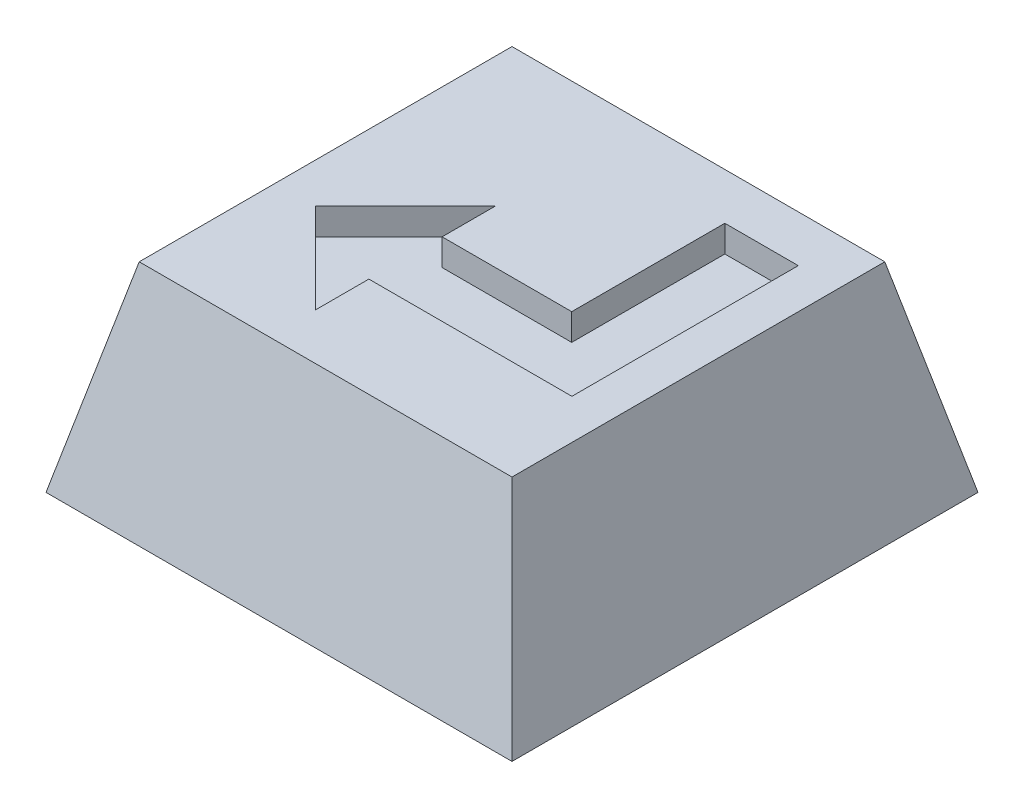
from build123d import *

# Parameters (mm, degrees)
SKETCH1_W           = 7
SKETCH1_H           = 7
BOSS_EXTRUDE1_DEPTH = 3
CUT_EXTRUDE1_DEPTH  = 7
CUT_EXTRUDE2_DEPTH  = 11
SKETCH4_R           = 1.8
CUT_EXTRUDE3_DEPTH  = 0.8
SKETCH5_W           = 1.947102418
SKETCH5_H           = 1.1
SKETCH5_W_2         = 1.102897582
SKETCH5_H_2         = 3.4
CUT_EXTRUDE4_DEPTH  = 0.4


with BuildPart() as part:
    # Sketch1 → Boss-Extrude1 (new body)
    with BuildSketch(Plane(origin=(0, 0, 0), x_dir=(1, 0, 0), z_dir=(0, 1, 0))):
        with Locations((3.5, 3.5)):
            Rectangle(SKETCH1_W, SKETCH1_H)
    extrude(amount=BOSS_EXTRUDE1_DEPTH)

    # Sketch2 → Cut-Extrude1 (cut)
    with BuildSketch(Plane.XY):
        Polygon((0, 0), (0.7, 3), (0, 3), align=None)
        Polygon((7, 0), (6.3, 3), (7, 3), align=None)
    extrude(amount=-CUT_EXTRUDE1_DEPTH, mode=Mode.SUBTRACT)

    # Sketch3 → Cut-Extrude2 (cut)
    with BuildSketch(Plane(origin=(0, 0, 0), x_dir=(0, 0, -1), z_dir=(1, 0, 0))):
        Polygon((0, 0), (0.7, 3), (0, 3), align=None)
        Polygon((7, 3), (6.3, 3), (7, 0), align=None)
    extrude(amount=CUT_EXTRUDE2_DEPTH, mode=Mode.SUBTRACT)

    # Sketch4 → Cut-Extrude3 (cut)
    with BuildSketch(Plane.XZ):
        with Locations(Location((3.5, -3.5, 0), (0, 0, 270))):
            Circle(SKETCH4_R)
    extrude(amount=-CUT_EXTRUDE3_DEPTH, mode=Mode.SUBTRACT)

    # Sketch5 → Cut-Extrude4 (cut)
    with BuildSketch(Plane(origin=(0, 3, 0), x_dir=(1, 0, 0), z_dir=(0, 1, 0))):
        Polygon((1.3, 2.75), (2.65, 1.4), (2.65, 2.2), (2.65, 3.3), (2.65, 4.1), align=None)
        with Locations((3.623551209, 2.75)):
            Rectangle(SKETCH5_W, SKETCH5_H)
        with Locations((5.148551209, 3.9)):
            Rectangle(SKETCH5_W_2, SKETCH5_H_2)
    extrude(amount=-CUT_EXTRUDE4_DEPTH, mode=Mode.SUBTRACT)


solid = part.part
